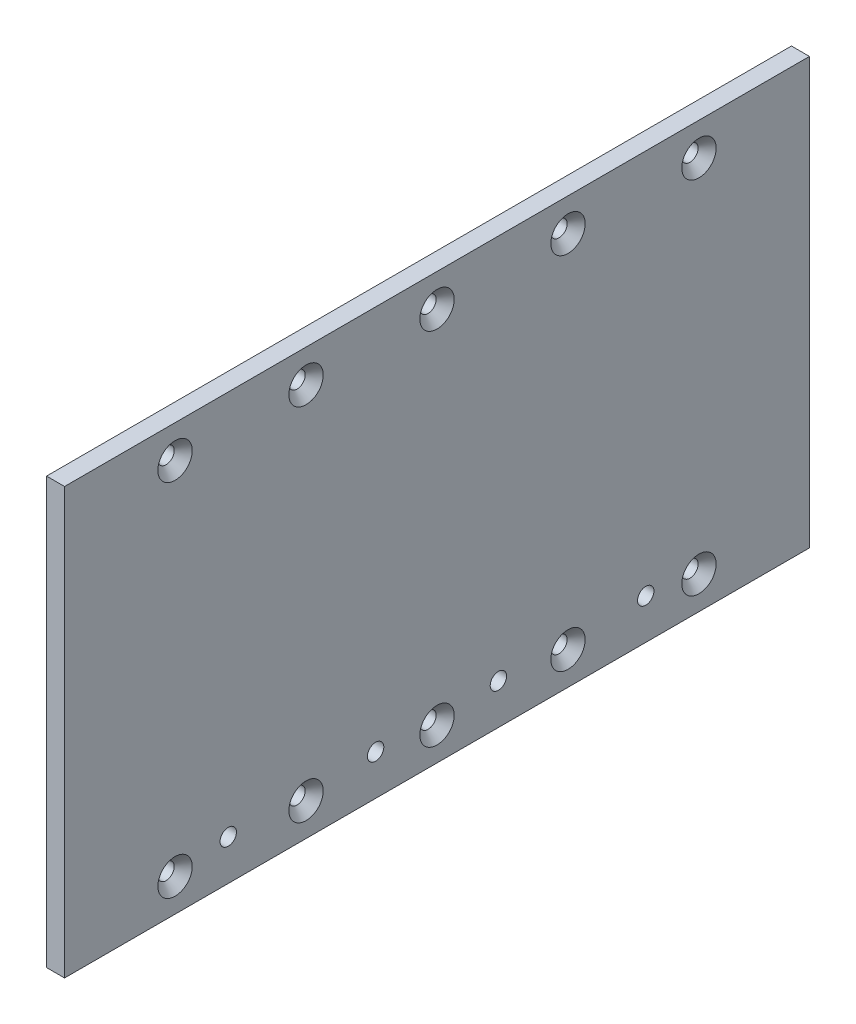
from build123d import *

# Parameters (mm, degrees)
SKETCH1_W                                            = 227.5
SKETCH1_H                                            = 130
BOSS_EXTRUDE1_DEPTH                                  = 5.5
CSK_FOR_M5_HEX_SOCKET_COUNTERSUNK_CAP_SC_D           = 5
CSK_FOR_M5_HEX_SOCKET_COUNTERSUNK_CAP_SC_CSINK_D     = 10.5
CSK_FOR_M5_HEX_SOCKET_COUNTERSUNK_CAP_SC_CSINK_ANGLE = 90
TAP_DRILL_FOR_M5X0_8_TAP1_D                          = 5


with BuildPart() as part:
    # Sketch1 → Boss-Extrude1 (new body)
    with BuildSketch(Plane(origin=(0, 0, 0), x_dir=(0, 0, -1), z_dir=(1, 0, 0))):
        Rectangle(SKETCH1_W, SKETCH1_H)
    extrude(amount=BOSS_EXTRUDE1_DEPTH)

    # CSK for M5 Hex Socket Countersunk Cap Screw1 (through all)
    with Locations(Plane(origin=(5.5, 0, 0), x_dir=(0, 0, -1), z_dir=(1, 0, 0))):
        with Locations((80, 55), (40, 55), (0, 55), (-40, 55), (-80, 55), (-80, -55), (-40, -55), (0, -55), (40, -55), (80, -55)):
            CounterSinkHole(CSK_FOR_M5_HEX_SOCKET_COUNTERSUNK_CAP_SC_D / 2, CSK_FOR_M5_HEX_SOCKET_COUNTERSUNK_CAP_SC_CSINK_D / 2, counter_sink_angle=CSK_FOR_M5_HEX_SOCKET_COUNTERSUNK_CAP_SC_CSINK_ANGLE)

    # Tap Drill for M5x0.8 Tap1 (through all)
    with Locations(Plane(origin=(5.5, 0, 0), x_dir=(0, 0, -1), z_dir=(1, 0, 0))):
        with Locations((-63.75, -52.653836842), (-18.75, -52.653836842), (18.75, -52.653836842), (63.75, -52.653836842)):
            Hole(TAP_DRILL_FOR_M5X0_8_TAP1_D / 2)


solid = part.part
